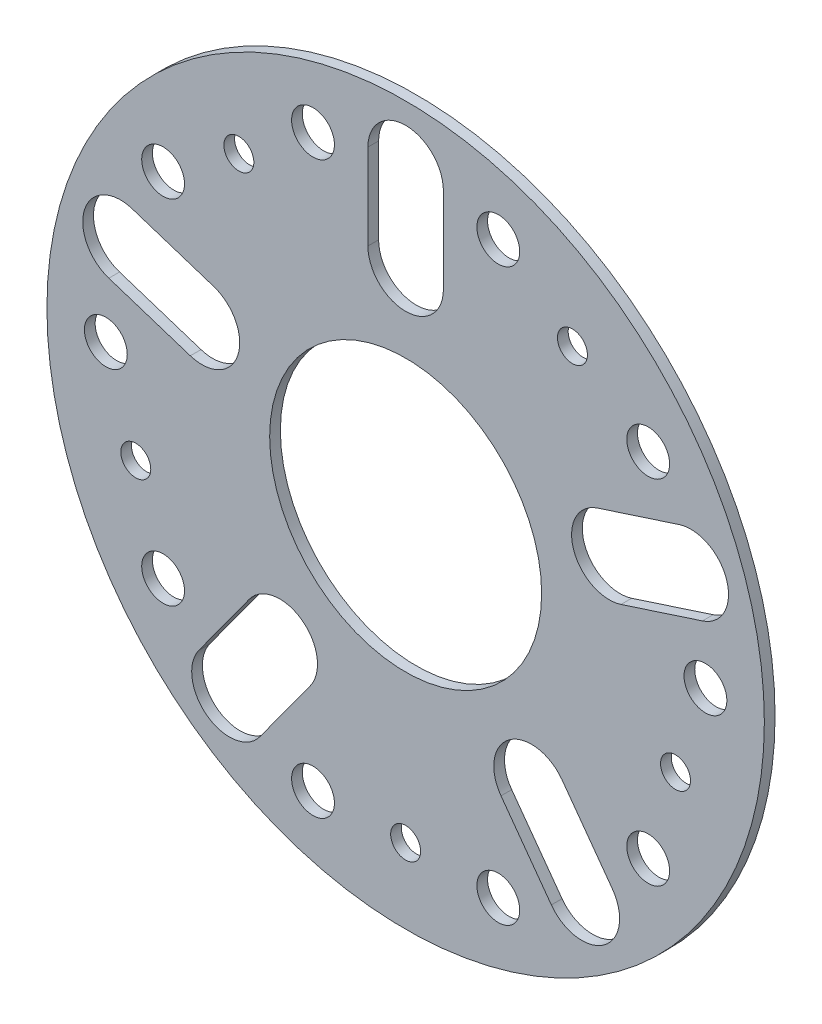
from build123d import *

# Parameters (mm, degrees)
SKETCH_1_R      = 33.5
SKETCH_1_R_2    = 12.7
SKETCH_1_R_3    = 1.4
SKETCH_1_R_4    = 2
EXTRUDE_1_DEPTH = 1


with BuildPart() as part:
    # 草图1 → 凸台-拉伸1 (new body)
    with BuildSketch(Plane.XY):
        Circle(SKETCH_1_R)
        Circle(SKETCH_1_R_2, mode=Mode.SUBTRACT)
        with Locations((0, -26.5)):
            Circle(SKETCH_1_R_3, mode=Mode.SUBTRACT)
        with Locations((-25.202997682, -8.188950351)):
            Circle(SKETCH_1_R_3, mode=Mode.SUBTRACT)
        with Locations((-15.576309186, 21.438950351)):
            Circle(SKETCH_1_R_3, mode=Mode.SUBTRACT)
        with Locations((15.576309186, 21.438950351)):
            Circle(SKETCH_1_R_3, mode=Mode.SUBTRACT)
        with Locations((25.202997682, -8.188950351)):
            Circle(SKETCH_1_R_3, mode=Mode.SUBTRACT)
        with Locations((-8.651773631, -26.627421273)):
            Circle(SKETCH_1_R_4, mode=Mode.SUBTRACT)
        with Locations(Location((8.651773631, -26.627421273, 0), (0, 0, 180))):
            Circle(SKETCH_1_R_4, mode=Mode.SUBTRACT)
        with Locations((-27.997727597, 0)):
            Circle(SKETCH_1_R_4, mode=Mode.SUBTRACT)
        with Locations(Location((-22.65063743, -16.456651379, 0), (0, 0, 180))):
            Circle(SKETCH_1_R_4, mode=Mode.SUBTRACT)
        with Locations((-8.651773631, 26.627421273)):
            Circle(SKETCH_1_R_4, mode=Mode.SUBTRACT)
        with Locations(Location((-22.65063743, 16.456651379, 0), (0, 0, 180))):
            Circle(SKETCH_1_R_4, mode=Mode.SUBTRACT)
        with Locations((22.65063743, 16.456651379)):
            Circle(SKETCH_1_R_4, mode=Mode.SUBTRACT)
        with Locations(Location((8.651773631, 26.627421273, 0), (0, 0, 180))):
            Circle(SKETCH_1_R_4, mode=Mode.SUBTRACT)
        with Locations((22.65063743, -16.456651379)):
            Circle(SKETCH_1_R_4, mode=Mode.SUBTRACT)
        with Locations(Location((27.997727597, 0, 0), (0, 0, 180))):
            Circle(SKETCH_1_R_4, mode=Mode.SUBTRACT)
        with BuildLine():
            Line((-19.308819678, -20.581224709), (-14.606537659, -14.109088754))
            ThreePointArc((-14.606537659, -14.109088754), (-9.684453912, -13.329507274), (-8.904872432, -18.251591021))
            Line((-8.904872432, -18.251591021), (-13.607154451, -24.723726976))
            ThreePointArc((-13.607154451, -24.723726976), (-18.529238198, -25.503308456), (-19.308819678, -20.581224709))
        make_face(mode=Mode.SUBTRACT)
        with BuildLine():
            Line((-25.540661294, 12.003830576), (-17.932209164, 9.531694621))
            ThreePointArc((-17.932209164, 9.531694621), (-15.669775592, 5.091418725), (-20.110051488, 2.828985154))
            Line((-20.110051488, 2.828985154), (-27.718503618, 5.301121109))
            ThreePointArc((-27.718503618, 5.301121109), (-29.98093719, 9.741397005), (-25.540661294, 12.003830576))
        make_face(mode=Mode.SUBTRACT)
        with BuildLine():
            Line((3.523822903, 28), (3.523822903, 20))
            ThreePointArc((3.523822903, 20), (0, 16.476177097), (-3.523822903, 20))
            Line((-3.523822903, 20), (-3.523822903, 28))
            ThreePointArc((-3.523822903, 28), (0, 31.523822903), (3.523822903, 28))
        make_face(mode=Mode.SUBTRACT)
        with BuildLine():
            Line((27.718503618, 5.301121109), (20.110051488, 2.828985154))
            ThreePointArc((20.110051488, 2.828985154), (15.669775592, 5.091418725), (17.932209164, 9.531694621))
            Line((17.932209164, 9.531694621), (25.540661294, 12.003830576))
            ThreePointArc((25.540661294, 12.003830576), (29.98093719, 9.741397005), (27.718503618, 5.301121109))
        make_face(mode=Mode.SUBTRACT)
        with BuildLine():
            Line((13.607154451, -24.723726976), (8.904872432, -18.251591021))
            ThreePointArc((8.904872432, -18.251591021), (9.684453912, -13.329507274), (14.606537659, -14.109088754))
            Line((14.606537659, -14.109088754), (19.308819678, -20.581224709))
            ThreePointArc((19.308819678, -20.581224709), (18.529238198, -25.503308456), (13.607154451, -24.723726976))
        make_face(mode=Mode.SUBTRACT)
    extrude(amount=EXTRUDE_1_DEPTH)


solid = part.part
